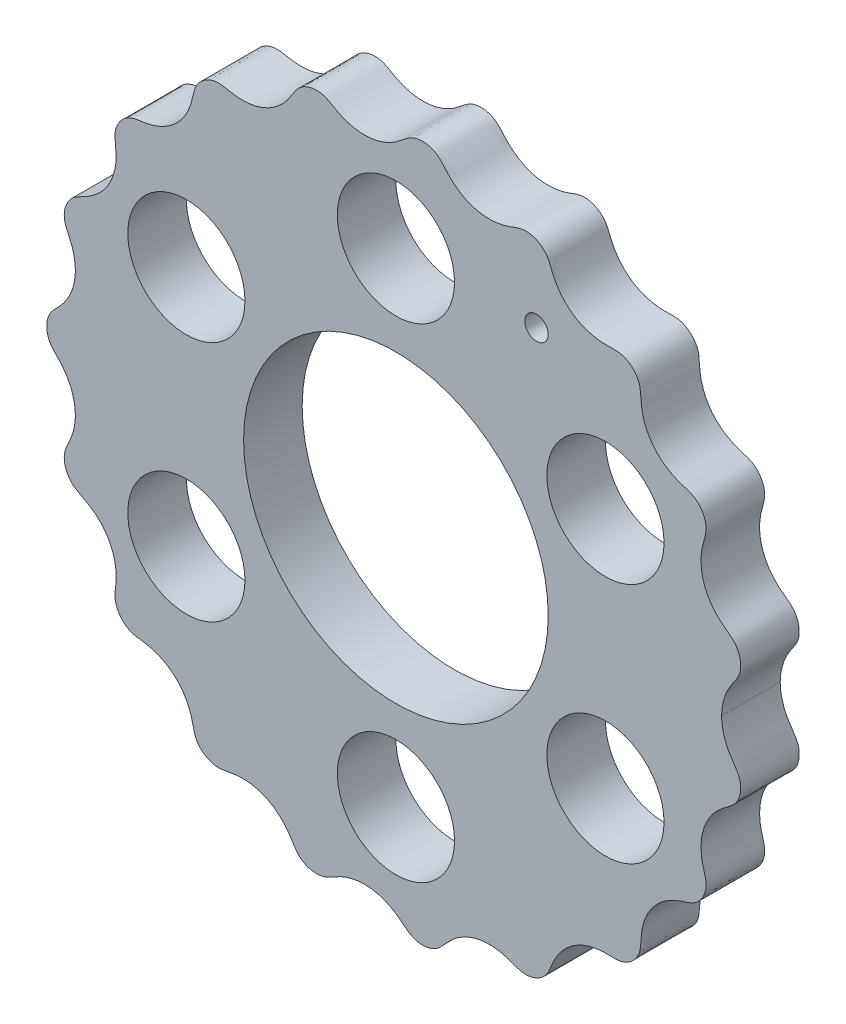
from build123d import *

# Parameters (mm, degrees)
BOSS_EXTRUDE1_DEPTH = 5
SKETCH2_R           = 13
SKETCH2_R_2         = 5
CUT_EXTRUDE1_DEPTH  = 43.654089603
SKETCH3_R           = 1
CUT_EXTRUDE2_DEPTH  = 43.654089603
CUT_EXTRUDE3_DEPTH  = 43.654089603


with BuildPart() as part:
    # Sketch1 → Boss-Extrude1 (new body)
    with BuildSketch(Plane.XY):
        with BuildLine():
            add(Edge.make_bspline(
                [(28, 0), (28, -0.031607794), (28.000789391, -0.095173902), (28.005525755, -0.245757399), (28.019326086, -0.439861268), (28.040961164, -0.616482718), (28.070350501, -0.794934034), (28.098472093, -0.937736676), (28.139322344, -1.115144331), (28.197244662, -1.325319125), (28.300892486, -1.635565804), (28.458642604, -2.006685548), (28.668088032, -2.395563273), (28.928215002, -2.80037836), (29.189681608, -3.161780759), (29.444754064, -3.571082816), (29.605798297, -4.064565501), (29.652918137, -4.626620464), (29.556654021, -5.231189162), (29.327153873, -5.768344938), (28.986297149, -6.210981216), (28.580427206, -6.525512659), (28.197486675, -6.798030109), (27.799996825, -7.121358321), (27.404607047, -7.507202652), (27.032482428, -7.970512965), (26.706330796, -8.514828581), (26.413302695, -9.211657), (26.251438875, -9.933273978), (26.216663756, -10.652450965), (26.287033133, -11.311050735), (26.385737699, -11.786793647), (26.504021433, -12.219948933), (26.622494171, -12.615516869), (26.695325575, -13.060523341), (26.664660067, -13.54855307), (26.519655846, -14.055126303), (26.245608373, -14.551808566), (25.887042333, -14.950855179), (25.471385133, -15.24393249), (25.03131998, -15.417348965), (24.610726837, -15.538975848), (24.164527862, -15.691099177), (23.700275628, -15.888132276), (23.105427802, -16.218766886), (22.53956767, -16.665049073), (22.055230805, -17.205935547), (21.669752323, -17.823580633), (21.42565652, -18.360731693), (21.260433844, -18.894643699), (21.162643882, -19.412199587), (21.112689386, -19.905492718), (21.094498138, -20.368148606), (21.053012922, -20.862501238), (20.881375511, -21.364540757), (20.57591829, -21.843251799), (20.135609481, -22.263720704), (19.634321897, -22.549252922), (19.106731473, -22.697644587), (18.60260508, -22.70733462), (18.141783316, -22.685028739), (17.63910796, -22.691060401), (17.099438227, -22.742871664), (16.529573831, -22.866674399), (15.943933229, -23.078382008), (15.278093513, -23.430068555), (14.692747008, -23.887334661), (14.204931744, -24.42944445), (13.837996841, -24.997872996), (13.613152588, -25.440036584), (13.433275756, -25.861845447), (13.282527262, -26.254985917), (13.072648388, -26.664451214), (12.748934464, -27.04493476), (12.321789669, -27.365459651), (11.799442579, -27.59587664), (11.276706532, -27.695200129), (10.78130439, -27.679350973), (10.340049125, -27.561421688), (9.951329073, -27.407604072), (9.522950605, -27.254106311), (9.049641692, -27.118655209), (8.388840217, -27.000061367), (7.663120595, -26.985676349), (6.93036574, -27.099542528), (6.217390687, -27.344899813), (5.658834075, -27.629674642), (5.176155087, -27.964045149), (4.767565282, -28.326118097), (4.418903404, -28.693269214), (4.120485623, -29.049409536), (3.772522925, -29.419108483), (3.304848005, -29.71243473), (2.754147859, -29.890925208), (2.146773278, -29.932738719), (1.589248405, -29.836110659), (1.105587205, -29.627733503), (0.71417636, -29.328499919), (0.364533333, -29.029925233), (-0.028367799, -28.733309513), (-0.47045994, -28.45415947), (-0.969914774, -28.21234573), (-1.524621917, -28.024945496), (-2.096874589, -27.911552355), (-2.676043085, -27.873611072), (-3.252990345, -27.910342589), (-3.817580804, -28.01958817), (-4.333541884, -28.186149818), (-4.797360885, -28.393401034), (-5.215409768, -28.618899434), (-5.592367418, -28.847426096), (-6.019210711, -29.058949793), (-6.519324313, -29.170764397), (-7.057773467, -29.166815824), (-7.609325551, -29.034349043), (-8.079686668, -28.801036689), (-8.458609902, -28.498106948), (-8.737991675, -28.148379256), (-8.948179734, -27.796339272), (-9.183841522, -27.418183046), (-9.46298228, -27.025023376), (-9.89317018, -26.528263808), (-10.435830545, -26.067373452), (-11.063248917, -25.696323354), (-11.758699629, -25.434985669), (-12.363814894, -25.299234737), (-12.95310346, -25.248195072), (-13.51401526, -25.268546477), (-14.042266274, -25.339057351), (-14.533281872, -25.442118731), (-15.058861896, -25.534533442), (-15.623528223, -25.481944425), (-16.171925598, -25.285915888), (-16.673841481, -24.953621848), (-17.052437871, -24.545388892), (-17.307990578, -24.097893954), (-17.439195953, -23.637404396), (-17.52711835, -23.203153521), (-17.645998359, -22.740668871), (-17.810639096, -22.257067945), (-18.102151448, -21.632046189), (-18.513113629, -21.031341537), (-19.024021846, -20.509148431), (-19.616634941, -20.083071264), (-20.134098627, -19.805250512), (-20.65049718, -19.606303042), (-21.151939853, -19.474775119), (-21.629104056, -19.389994891), (-22.075135097, -19.336471036), (-22.553018741, -19.250202468), (-23.030373049, -19.036443065), (-23.478926292, -18.69128849), (-23.860652457, -18.212594076), (-24.10193098, -17.682815032), (-24.200337707, -17.136759129), (-24.160939597, -16.628102048), (-24.101414735, -16.164975194), (-24.068545385, -15.657122594), (-24.081295518, -15.108587934), (-24.165539546, -14.524481601), (-24.338847541, -13.918660984), (-24.646212755, -13.229279662), (-25.062435608, -12.616598909), (-25.566029832, -12.097280409), (-26.099765663, -11.696331925), (-26.518591227, -11.442780427), (-26.919851592, -11.233649018), (-27.294141099, -11.052353257), (-27.676000835, -10.806303036), (-28.019439933, -10.452794437), (-28.297086409, -10.002715516), (-28.479139599, -9.465413716), (-28.532211586, -8.933514091), (-28.470422962, -8.432585295), (-28.30510669, -7.992998887), (-28.111109147, -7.603856207), (-27.920859103, -7.176405122), (-27.750155987, -6.705838026), (-27.587332984, -6.050500223), (-27.525855635, -5.327505077), (-27.592179736, -4.588799401), (-27.791060781, -3.861084734), (-28.039472038, -3.284473953), (-28.339718127, -2.784159099), (-28.66836889, -2.358383767), (-29.000421457, -1.993187612), (-29.31931866, -1.67875971), (-29.644802089, -1.306256706), (-29.889490433, -0.822075077), (-30.018167595, -0.260629936), (-30.005603598, 0.351165926), (-29.857670959, 0.902647528), (-29.600525577, 1.369935874), (-29.261270256, 1.735325411), (-28.93208093, 2.064249021), (-28.602225255, 2.437898937), (-28.287867883, 2.863964262), (-28.00791907, 3.351112859), (-27.780139784, 3.898808345), (-27.591392943, 4.602767733), (-27.52652236, 5.325017915), (-27.585693157, 6.040729865), (-27.747665385, 6.697782161), (-27.918040246, 7.169552851), (-28.108310492, 7.598064876), (-28.302704998, 7.987933686), (-28.469417458, 8.427972934), (-28.532299241, 8.929815992), (-28.479856748, 9.462293119), (-28.298413482, 9.99977617), (-28.021630931, 10.449766164), (-27.679597868, 10.803169143), (-27.299132875, 11.049699967), (-26.925659315, 11.230826849), (-26.525069425, 11.439193824), (-26.106771915, 11.691660483), (-25.573443616, 12.090790558), (-25.06930278, 12.608299357), (-24.651696231, 13.219664458), (-24.342466537, 13.908552639), (-24.167461761, 14.515140855), (-24.081973824, 15.100196544), (-24.068325043, 15.649739078), (-24.100780663, 16.158568438), (-24.160140276, 16.622562443), (-24.200658465, 17.13203169), (-24.10321497, 17.679315963), (-23.862349693, 18.209869298), (-23.481200106, 18.689000548), (-23.033499346, 19.034377339), (-22.557560754, 19.248698187), (-22.080762596, 19.335831681), (-21.635555765, 19.38906891), (-21.159259908, 19.473240133), (-20.658614704, 19.603726927), (-20.142894794, 19.801310606), (-19.625871508, 20.077399458), (-19.032424918, 20.50179032), (-18.519960475, 21.022894025), (-18.107062631, 21.623399459), (-17.813780942, 22.249170887), (-17.648077145, 22.733499759), (-17.528534764, 23.19680441), (-17.440339572, 23.631857935), (-17.309941788, 24.093521039), (-17.054775403, 24.542465351), (-16.676326181, 24.951558118), (-16.174772931, 25.284465933), (-15.627121463, 25.480954405), (-15.063613699, 25.53464941), (-14.53876576, 25.443428509), (-14.04870116, 25.340176789), (-13.521478788, 25.269265487), (-12.961627928, 25.248019408), (-12.373324213, 25.297856121), (-11.76902426, 25.431982843), (-11.073166575, 25.691475967), (-10.444518868, 26.06110741), (-9.900106679, 26.521373564), (-9.468104218, 27.018429456), (-9.187878067, 27.412050228), (-8.951432681, 27.790813845), (-8.741100667, 28.143685845), (-8.462070912, 28.49483955), (-8.082897568, 28.799133848), (-7.612387114, 29.033287178), (-7.060975379, 29.1663805), (-6.523070969, 29.171013546), (-6.023763363, 29.060429515), (-5.597243323, 28.850320465), (-5.221020217, 28.622168744), (-4.804020718, 28.396750924), (-4.34144437, 28.189229502), (-3.826867386, 28.022064798), (-3.263707624, 27.911793469), (-2.687474286, 27.873644486), (-2.108219562, 27.910045249), (-1.535105702, 28.022097512), (-0.97885137, 28.208615353), (-0.477944331, 28.449973443), (-0.034531935, 28.728967322), (0.359423942, 29.025790431), (0.709883842, 29.324749458), (1.101398688, 29.625371261), (1.585597839, 29.835198804), (2.143546411, 29.932605798), (2.750978647, 29.891510172), (3.301376688, 29.713852462), (3.768744645, 29.422072446), (4.11686597, 29.053820749), (4.41453018, 28.698212895), (4.76216589, 28.331440644), (5.169402529, 27.969392238), (5.650549964, 27.634732213), (6.207434141, 27.349212317), (6.919527271, 27.102132867), (7.652319978, 26.986342148), (8.378999847, 26.999072766), (9.041413413, 27.116706278), (9.515886034, 27.25178552), (9.945292149, 27.405246585), (10.33471801, 27.559502076), (10.776559668, 27.678784076), (11.27298784, 27.695621715), (11.796365764, 27.596880585), (12.318969019, 27.367054398), (12.746103509, 27.047404294), (13.069867171, 26.668359131), (13.280348959, 26.260238466), (13.430902373, 25.867900328), (13.610047168, 25.446819046), (13.833812808, 25.005248611), (14.198936635, 24.437339599), (14.684877711, 23.894794481), (15.268789228, 23.436238019), (15.933972287, 23.08272939), (16.520210963, 22.869297394), (17.090909026, 22.744179265), (17.631517933, 22.691404539), (18.135170603, 22.684880483), (18.596890924, 22.707025842), (19.101983826, 22.698454926), (19.630927767, 22.550859708), (20.133035028, 22.265670012), (20.573843353, 21.845719759), (20.879586327, 21.367847037), (21.051951154, 20.867181872), (21.094363585, 20.373838874), (21.112254643, 19.912049046), (21.16163916, 19.419670361), (21.258405524, 18.902975501), (21.422298212, 18.369812269), (21.664688853, 17.833186737), (22.048443403, 17.21480426), (22.531611071, 16.672432705), (23.097165354, 16.224250491), (23.692651226, 15.891818586), (24.157556718, 15.693706207), (24.604524485, 15.54087327), (25.02589507, 15.418997814), (25.467227187, 15.246310396), (25.884329381, 14.953452562), (26.243767774, 14.554469426), (26.51837393, 14.058101434), (26.663898396, 13.552209679), (26.69541457, 13.065287404), (26.6238773, 12.620985814), (26.505881537, 12.226105108), (26.387505972, 11.793950469), (26.288382081, 11.319319619), (26.216988653, 10.662261885), (26.249859599, 9.94855148), (26.406838821, 9.235805384), (26.689951889, 8.549703765), (27.001615686, 8.017122716), (27.363753231, 7.553123578), (27.758445657, 7.157943098), (28.167019044, 6.819797091), (28.574030178, 6.530556726), (28.994300302, 6.205710581), (29.333751672, 5.754976571), (29.558721638, 5.219338186), (29.652257295, 4.624684413), (29.606457168, 4.068284102), (29.446581732, 3.575497361), (29.193157181, 3.166250105), (28.964301686, 2.851052692), (28.781094604, 2.570740733), (28.629273839, 2.317340988), (28.50744616, 2.091446772), (28.389956154, 1.844472549), (28.280988718, 1.575591254), (28.188669511, 1.299970851), (28.113803282, 1.020663634), (28.056938461, 0.732470454), (28.02335876, 0.489756214), (28.00621284, 0.257787873), (28.001072048, 0.107571885), (28.000106821, 0.044134849), (28.000017774, 0.012592221)],
                knots=[0.065005571, 0.065005571, 0.065005571, 0.065005571, 0.065005571, 0.065632382, 0.066259192, 0.067512814, 0.068139624, 0.068766435, 0.069393246, 0.070020056, 0.071273678, 0.072527299, 0.075034542, 0.076961332, 0.078888123, 0.080814913, 0.082741704, 0.085241291, 0.087740877, 0.090464736, 0.093188594, 0.095219679, 0.097250764, 0.099281849, 0.101312934, 0.104041079, 0.106769225, 0.109497371, 0.112225517, 0.117036609, 0.119442155, 0.121847701, 0.12362792, 0.125408138, 0.127188357, 0.128968576, 0.131365645, 0.133762715, 0.136211626, 0.138660537, 0.140550415, 0.142440294, 0.144330173, 0.146220051, 0.148675368, 0.151130685, 0.156041319, 0.158578939, 0.161116559, 0.16365418, 0.1661918, 0.168192015, 0.17019223, 0.172192445, 0.17419266, 0.176713076, 0.179233492, 0.181907479, 0.184581467, 0.186574673, 0.188567879, 0.190561085, 0.192554291, 0.195232047, 0.197909804, 0.20058756, 0.203265317, 0.208179231, 0.210636188, 0.213093145, 0.214909768, 0.216726391, 0.218543014, 0.220359637, 0.222807476, 0.225255316, 0.227684467, 0.230113618, 0.231916809, 0.233720001, 0.235523192, 0.237326383, 0.239764514, 0.242202645, 0.247078907, 0.249774714, 0.25247052, 0.255166327, 0.257862134, 0.259869718, 0.261877303, 0.263884888, 0.265892473, 0.268584812, 0.271277151, 0.27377903, 0.276280908, 0.278267134, 0.28025336, 0.282239586, 0.284225812, 0.286744865, 0.289263918, 0.291782971, 0.294302024, 0.29677641, 0.299250796, 0.301725182, 0.304199568, 0.306102874, 0.30800618, 0.309909486, 0.311812791, 0.314280353, 0.316747916, 0.31912638, 0.321504844, 0.323272024, 0.325039205, 0.326806386, 0.328573567, 0.330960231, 0.333346894, 0.338120221, 0.340786943, 0.343453665, 0.346120387, 0.348787109, 0.350955367, 0.353123626, 0.355291884, 0.357460142, 0.360114886, 0.362769631, 0.36525072, 0.36773181, 0.36964497, 0.371558131, 0.373471291, 0.375384451, 0.377872698, 0.380360944, 0.385337437, 0.387863626, 0.390389815, 0.392916004, 0.395442193, 0.39738266, 0.399323128, 0.401263595, 0.403204062, 0.405722153, 0.408240244, 0.410945845, 0.413651446, 0.415669141, 0.417686835, 0.41970453, 0.421722225, 0.42443151, 0.427140795, 0.42985008, 0.432559365, 0.437408183, 0.439832592, 0.442257001, 0.444050448, 0.445843895, 0.447637342, 0.449430789, 0.451846436, 0.454262083, 0.456692563, 0.459123043, 0.460999481, 0.462875918, 0.464752356, 0.466628794, 0.469065006, 0.471501219, 0.476373643, 0.479073102, 0.481772561, 0.48447202, 0.487171478, 0.489105866, 0.491040254, 0.492974642, 0.49490903, 0.497596451, 0.500283872, 0.502817705, 0.505351538, 0.507361982, 0.509372426, 0.51138287, 0.513393314, 0.515944415, 0.518495517, 0.521046619, 0.523597721, 0.528480538, 0.530921947, 0.533363356, 0.535243503, 0.537123649, 0.539003796, 0.540883942, 0.543319302, 0.545754661, 0.548165261, 0.550575862, 0.552365695, 0.554155528, 0.555945361, 0.557735194, 0.560154477, 0.56257376, 0.567412327, 0.570126751, 0.572841176, 0.5755556, 0.578270025, 0.580291379, 0.582312733, 0.584334088, 0.586355442, 0.589065971, 0.5917765, 0.594289569, 0.596802638, 0.59873938, 0.600676121, 0.602612862, 0.604549603, 0.607070647, 0.609591691, 0.612112735, 0.614633779, 0.619620609, 0.622114024, 0.624607439, 0.626524293, 0.628441148, 0.630358003, 0.632274858, 0.634760986, 0.637247113, 0.639896985, 0.642546857, 0.644711256, 0.646875655, 0.649040054, 0.651204452, 0.653866281, 0.656528109, 0.659189937, 0.661851765, 0.666635362, 0.669027161, 0.671418959, 0.673189665, 0.67496037, 0.676731076, 0.678501781, 0.680885305, 0.683268829, 0.685731329, 0.688193829, 0.690093472, 0.691993115, 0.693892758, 0.695792401, 0.698261608, 0.700730814, 0.70320002, 0.705669226, 0.708193332, 0.710717438, 0.713241544, 0.71576565, 0.717755672, 0.719745693, 0.721735714, 0.723725736, 0.726232666, 0.728739596, 0.731426962, 0.734114328, 0.736118005, 0.738121682, 0.74012536, 0.742129037, 0.744819939, 0.747510841, 0.750201743, 0.752892646, 0.757779148, 0.760222399, 0.76266565, 0.764472495, 0.766279341, 0.768086186, 0.769893031, 0.77232723, 0.774761429, 0.77720418, 0.77964693, 0.781459893, 0.783272856, 0.785085819, 0.786898782, 0.789350624, 0.791802466, 0.796706149, 0.799388815, 0.80207148, 0.804754146, 0.807436812, 0.809433927, 0.811431043, 0.813428158, 0.815425273, 0.818104265, 0.820783257, 0.823298646, 0.825814036, 0.827810441, 0.829806846, 0.831803251, 0.833799656, 0.836332235, 0.838864814, 0.841397392, 0.843929971, 0.84885098, 0.851311484, 0.853771989, 0.855665504, 0.85755902, 0.859452536, 0.861346052, 0.863800041, 0.866254031, 0.868646044, 0.871038058, 0.872814713, 0.874591369, 0.876368024, 0.878144679, 0.880545094, 0.882945508, 0.887746338, 0.890399934, 0.89305353, 0.895707125, 0.898360721, 0.900518645, 0.902676569, 0.904834493, 0.906992417, 0.909634081, 0.912275745, 0.914770313, 0.917264881, 0.919187956, 0.921111031, 0.923034106, 0.923995643, 0.924957181, 0.926208222, 0.927459264, 0.928710306, 0.929961347, 0.931212389, 0.932463431, 0.933714472, 0.934339993, 0.934965514, 0.934965514, 0.934965514, 0.934965514, 0.934965514], degree=4))
            Line((28.000017774, 0.012592221), (28, 0))
        make_face()
    extrude(amount=BOSS_EXTRUDE1_DEPTH)

    # Sketch2 → Cut-Extrude1 (cut, through all)
    with BuildSketch(Plane.XY.offset(5)):
        Circle(SKETCH2_R)
        with Locations((0, 20.65)):
            Circle(SKETCH2_R_2)
        with Locations((17.883424588, 10.325)):
            Circle(SKETCH2_R_2)
        with Locations((17.883424588, -10.325)):
            Circle(SKETCH2_R_2)
        with Locations((0, -20.65)):
            Circle(SKETCH2_R_2)
        with Locations((-17.883424588, -10.325)):
            Circle(SKETCH2_R_2)
        with Locations((-17.883424588, 10.325)):
            Circle(SKETCH2_R_2)
    extrude(amount=-CUT_EXTRUDE1_DEPTH, mode=Mode.SUBTRACT)

    # Sketch3 → Cut-Extrude2 (cut, through all)
    with BuildSketch(Plane.XY.offset(5)):
        with Locations((12, 20.784609691)):
            Circle(SKETCH3_R)
    extrude(amount=-CUT_EXTRUDE2_DEPTH, mode=Mode.SUBTRACT)

    # Sketch4 → Cut-Extrude3 (cut, through all)
    with BuildSketch(Plane.XY.offset(5)):
        with BuildLine():
            Line((28, 0), (28.000017774, 0.012592221))
            add(Edge.make_bspline(
                [(28.000017774, 0.012592221), (28.000106821, 0.044134849), (28.001072048, 0.107571885), (28.00621284, 0.257787873), (28.02335876, 0.489756214), (28.056938461, 0.732470454), (28.113803282, 1.020663634), (28.188669511, 1.299970851), (28.280988718, 1.575591254), (28.389956154, 1.844472549), (28.50744616, 2.091446772), (28.629273839, 2.317340988), (28.781094604, 2.570740733), (28.964301686, 2.851052692), (29.193157181, 3.166250105), (29.446581732, 3.575497361), (29.606457168, 4.068284102), (29.652257295, 4.624684413), (29.558721638, 5.219338186), (29.333751672, 5.754976571), (28.994300302, 6.205710581), (28.574030178, 6.530556726), (28.167019044, 6.819797091), (27.758445657, 7.157943098), (27.363753231, 7.553123578), (27.001615686, 8.017122716), (26.689951889, 8.549703765), (26.406838821, 9.235805384), (26.249859599, 9.94855148), (26.216988653, 10.662261885), (26.288382081, 11.319319619), (26.387505972, 11.793950469), (26.505881537, 12.226105108), (26.6238773, 12.620985814), (26.69541457, 13.065287404), (26.663898396, 13.552209679), (26.51837393, 14.058101434), (26.243767774, 14.554469426), (25.884329381, 14.953452562), (25.467227187, 15.246310396), (25.02589507, 15.418997814), (24.604524485, 15.54087327), (24.157556718, 15.693706207), (23.692651226, 15.891818586), (23.097165354, 16.224250491), (22.531611071, 16.672432705), (22.048443403, 17.21480426), (21.664688853, 17.833186737), (21.422298212, 18.369812269), (21.258405524, 18.902975501), (21.16163916, 19.419670361), (21.112254643, 19.912049046), (21.094363585, 20.373838874), (21.051951154, 20.867181872), (20.879586327, 21.367847037), (20.573843353, 21.845719759), (20.133035028, 22.265670012), (19.630927767, 22.550859708), (19.101983826, 22.698454926), (18.596890924, 22.707025842), (18.135170603, 22.684880483), (17.631517933, 22.691404539), (17.090909026, 22.744179265), (16.520210963, 22.869297394), (15.933972287, 23.08272939), (15.268789228, 23.436238019), (14.684877711, 23.894794481), (14.198936635, 24.437339599), (13.833812808, 25.005248611), (13.610047168, 25.446819046), (13.430902373, 25.867900328), (13.280348959, 26.260238466), (13.069867171, 26.668359131), (12.746103509, 27.047404294), (12.318969019, 27.367054398), (11.796365764, 27.596880585), (11.27298784, 27.695621715), (10.776559668, 27.678784076), (10.33471801, 27.559502076), (9.945292149, 27.405246585), (9.515886034, 27.25178552), (9.041413413, 27.116706278), (8.378999847, 26.999072766), (7.652319978, 26.986342148), (6.919527271, 27.102132867), (6.207434141, 27.349212317), (5.650549964, 27.634732213), (5.169402529, 27.969392238), (4.76216589, 28.331440644), (4.41453018, 28.698212895), (4.11686597, 29.053820749), (3.768744645, 29.422072446), (3.301376688, 29.713852462), (2.750978647, 29.891510172), (2.143546411, 29.932605798), (1.585597839, 29.835198804), (1.101398688, 29.625371261), (0.709883842, 29.324749458), (0.359423942, 29.025790431), (-0.034531935, 28.728967322), (-0.477944331, 28.449973443), (-0.97885137, 28.208615353), (-1.535105702, 28.022097512), (-2.108219562, 27.910045249), (-2.687474286, 27.873644486), (-3.263707624, 27.911793469), (-3.826867386, 28.022064798), (-4.34144437, 28.189229502), (-4.804020718, 28.396750924), (-5.221020217, 28.622168744), (-5.597243323, 28.850320465), (-6.023763363, 29.060429515), (-6.523070969, 29.171013546), (-7.060975379, 29.1663805), (-7.612387114, 29.033287178), (-8.082897568, 28.799133848), (-8.462070912, 28.49483955), (-8.741100667, 28.143685845), (-8.951432681, 27.790813845), (-9.187878067, 27.412050228), (-9.468104218, 27.018429456), (-9.900106679, 26.521373564), (-10.444518868, 26.06110741), (-11.073166575, 25.691475967), (-11.76902426, 25.431982843), (-12.373324213, 25.297856121), (-12.961627928, 25.248019408), (-13.521478788, 25.269265487), (-14.04870116, 25.340176789), (-14.53876576, 25.443428509), (-15.063613699, 25.53464941), (-15.627121463, 25.480954405), (-16.174772931, 25.284465933), (-16.676326181, 24.951558118), (-17.054775403, 24.542465351), (-17.309941788, 24.093521039), (-17.440339572, 23.631857935), (-17.528534764, 23.19680441), (-17.648077145, 22.733499759), (-17.813780942, 22.249170887), (-18.107062631, 21.623399459), (-18.519960475, 21.022894025), (-19.032424918, 20.50179032), (-19.625871508, 20.077399458), (-20.142894794, 19.801310606), (-20.658614704, 19.603726927), (-21.159259908, 19.473240133), (-21.635555765, 19.38906891), (-22.080762596, 19.335831681), (-22.557560754, 19.248698187), (-23.033499346, 19.034377339), (-23.481200106, 18.689000548), (-23.862349693, 18.209869298), (-24.10321497, 17.679315963), (-24.200658465, 17.13203169), (-24.160140276, 16.622562443), (-24.100780663, 16.158568438), (-24.068325043, 15.649739078), (-24.081973824, 15.100196544), (-24.167461761, 14.515140855), (-24.342466537, 13.908552639), (-24.651696231, 13.219664458), (-25.06930278, 12.608299357), (-25.573443616, 12.090790558), (-26.106771915, 11.691660483), (-26.525069425, 11.439193824), (-26.925659315, 11.230826849), (-27.299132875, 11.049699967), (-27.679597868, 10.803169143), (-28.021630931, 10.449766164), (-28.298413482, 9.99977617), (-28.479856748, 9.462293119), (-28.532299241, 8.929815992), (-28.469417458, 8.427972934), (-28.302704998, 7.987933686), (-28.108310492, 7.598064876), (-27.918040246, 7.169552851), (-27.747665385, 6.697782161), (-27.585693157, 6.040729865), (-27.52652236, 5.325017915), (-27.591392943, 4.602767733), (-27.780139784, 3.898808345), (-28.00791907, 3.351112859), (-28.287867883, 2.863964262), (-28.602225255, 2.437898937), (-28.93208093, 2.064249021), (-29.261270256, 1.735325411), (-29.600525577, 1.369935874), (-29.857670959, 0.902647528), (-30.005603598, 0.351165926), (-30.018167595, -0.260629936), (-29.889490433, -0.822075077), (-29.644802089, -1.306256706), (-29.31931866, -1.67875971), (-29.000421457, -1.993187612), (-28.66836889, -2.358383767), (-28.339718127, -2.784159099), (-28.039472038, -3.284473953), (-27.791060781, -3.861084734), (-27.592179736, -4.588799401), (-27.525855635, -5.327505077), (-27.587332984, -6.050500223), (-27.750155987, -6.705838026), (-27.920859103, -7.176405122), (-28.111109147, -7.603856207), (-28.30510669, -7.992998887), (-28.470422962, -8.432585295), (-28.532211586, -8.933514091), (-28.479139599, -9.465413716), (-28.297086409, -10.002715516), (-28.019439933, -10.452794437), (-27.676000835, -10.806303036), (-27.294141099, -11.052353257), (-26.919851592, -11.233649018), (-26.518591227, -11.442780427), (-26.099765663, -11.696331925), (-25.566029832, -12.097280409), (-25.062435608, -12.616598909), (-24.646212755, -13.229279662), (-24.338847541, -13.918660984), (-24.165539546, -14.524481601), (-24.081295518, -15.108587934), (-24.068545385, -15.657122594), (-24.101414735, -16.164975194), (-24.160939597, -16.628102048), (-24.200337707, -17.136759129), (-24.10193098, -17.682815032), (-23.860652457, -18.212594076), (-23.478926292, -18.69128849), (-23.030373049, -19.036443065), (-22.553018741, -19.250202468), (-22.075135097, -19.336471036), (-21.629104056, -19.389994891), (-21.151939853, -19.474775119), (-20.65049718, -19.606303042), (-20.134098627, -19.805250512), (-19.616634941, -20.083071264), (-19.024021846, -20.509148431), (-18.513113629, -21.031341537), (-18.102151448, -21.632046189), (-17.810639096, -22.257067945), (-17.645998359, -22.740668871), (-17.52711835, -23.203153521), (-17.439195953, -23.637404396), (-17.307990578, -24.097893954), (-17.052437871, -24.545388892), (-16.673841481, -24.953621848), (-16.171925598, -25.285915888), (-15.623528223, -25.481944425), (-15.058861896, -25.534533442), (-14.533281872, -25.442118731), (-14.042266274, -25.339057351), (-13.51401526, -25.268546477), (-12.95310346, -25.248195072), (-12.363814894, -25.299234737), (-11.758699629, -25.434985669), (-11.063248917, -25.696323354), (-10.435830545, -26.067373452), (-9.89317018, -26.528263808), (-9.46298228, -27.025023376), (-9.183841522, -27.418183046), (-8.948179734, -27.796339272), (-8.737991675, -28.148379256), (-8.458609902, -28.498106948), (-8.079686668, -28.801036689), (-7.609325551, -29.034349043), (-7.057773467, -29.166815824), (-6.519324313, -29.170764397), (-6.019210711, -29.058949793), (-5.592367418, -28.847426096), (-5.215409768, -28.618899434), (-4.797360885, -28.393401034), (-4.333541884, -28.186149818), (-3.817580804, -28.01958817), (-3.252990345, -27.910342589), (-2.676043085, -27.873611072), (-2.096874589, -27.911552355), (-1.524621917, -28.024945496), (-0.969914774, -28.21234573), (-0.47045994, -28.45415947), (-0.028367799, -28.733309513), (0.364533333, -29.029925233), (0.71417636, -29.328499919), (1.105587205, -29.627733503), (1.589248405, -29.836110659), (2.146773278, -29.932738719), (2.754147859, -29.890925208), (3.304848005, -29.71243473), (3.772522925, -29.419108483), (4.120485623, -29.049409536), (4.418903404, -28.693269214), (4.767565282, -28.326118097), (5.176155087, -27.964045149), (5.658834075, -27.629674642), (6.217390687, -27.344899813), (6.93036574, -27.099542528), (7.663120595, -26.985676349), (8.388840217, -27.000061367), (9.049641692, -27.118655209), (9.522950605, -27.254106311), (9.951329073, -27.407604072), (10.340049125, -27.561421688), (10.78130439, -27.679350973), (11.276706532, -27.695200129), (11.799442579, -27.59587664), (12.321789669, -27.365459651), (12.748934464, -27.04493476), (13.072648388, -26.664451214), (13.282527262, -26.254985917), (13.433275756, -25.861845447), (13.613152588, -25.440036584), (13.837996841, -24.997872996), (14.204931744, -24.42944445), (14.692747008, -23.887334661), (15.278093513, -23.430068555), (15.943933229, -23.078382008), (16.529573831, -22.866674399), (17.099438227, -22.742871664), (17.63910796, -22.691060401), (18.141783316, -22.685028739), (18.60260508, -22.70733462), (19.106731473, -22.697644587), (19.634321897, -22.549252922), (20.135609481, -22.263720704), (20.57591829, -21.843251799), (20.881375511, -21.364540757), (21.053012922, -20.862501238), (21.094498138, -20.368148606), (21.112689386, -19.905492718), (21.162643882, -19.412199587), (21.260433844, -18.894643699), (21.42565652, -18.360731693), (21.669752323, -17.823580633), (22.055230805, -17.205935547), (22.53956767, -16.665049073), (23.105427802, -16.218766886), (23.700275628, -15.888132276), (24.164527862, -15.691099177), (24.610726837, -15.538975848), (25.03131998, -15.417348965), (25.471385133, -15.24393249), (25.887042333, -14.950855179), (26.245608373, -14.551808566), (26.519655846, -14.055126303), (26.664660067, -13.54855307), (26.695325575, -13.060523341), (26.622494171, -12.615516869), (26.504021433, -12.219948933), (26.385737699, -11.786793647), (26.287033133, -11.311050735), (26.216663756, -10.652450965), (26.251438875, -9.933273978), (26.413302695, -9.211657), (26.706330796, -8.514828581), (27.032482428, -7.970512965), (27.404607047, -7.507202652), (27.799996825, -7.121358321), (28.197486675, -6.798030109), (28.580427206, -6.525512659), (28.986297149, -6.210981216), (29.327153873, -5.768344938), (29.556654021, -5.231189162), (29.652918137, -4.626620464), (29.605798297, -4.064565501), (29.444754064, -3.571082816), (29.189681608, -3.161780759), (28.928215002, -2.80037836), (28.668088032, -2.395563273), (28.458642604, -2.006685548), (28.300892486, -1.635565804), (28.197244662, -1.325319125), (28.139322344, -1.115144331), (28.098472093, -0.937736676), (28.070350501, -0.794934034), (28.040961164, -0.616482718), (28.019326086, -0.439861268), (28.005525755, -0.245757399), (28.000789391, -0.095173902), (28, -0.031607794), (28, 0)],
                knots=[0.065005571, 0.065005571, 0.065005571, 0.065005571, 0.065005571, 0.065631092, 0.066256613, 0.067507655, 0.068758696, 0.070009738, 0.07126078, 0.072511821, 0.073762863, 0.075013905, 0.075975442, 0.076936979, 0.078860054, 0.080783129, 0.082706204, 0.085200772, 0.08769534, 0.090337004, 0.092978668, 0.095136592, 0.097294516, 0.09945244, 0.101610364, 0.10426396, 0.106917556, 0.109571151, 0.112224747, 0.117025577, 0.119425992, 0.121826406, 0.123603061, 0.125379717, 0.127156372, 0.128933027, 0.131325041, 0.133717055, 0.136171044, 0.138625033, 0.140518549, 0.142412065, 0.144305581, 0.146199097, 0.148659601, 0.151120105, 0.156041114, 0.158573693, 0.161106272, 0.16363885, 0.166171429, 0.168167834, 0.170164239, 0.172160645, 0.17415705, 0.176672439, 0.179187828, 0.18186682, 0.184545812, 0.186542927, 0.188540043, 0.190537158, 0.192534273, 0.195216939, 0.197899605, 0.200582271, 0.203264936, 0.20816862, 0.210620461, 0.213072303, 0.214885266, 0.216698229, 0.218511192, 0.220324155, 0.222766905, 0.225209656, 0.227643855, 0.230078054, 0.231884899, 0.233691745, 0.23549859, 0.237305435, 0.239748686, 0.242191937, 0.24707844, 0.249769342, 0.252460244, 0.255151146, 0.257842049, 0.259845726, 0.261849403, 0.26385308, 0.265856757, 0.268544123, 0.271231489, 0.273738419, 0.276245349, 0.278235371, 0.280225392, 0.282215414, 0.284205435, 0.286729541, 0.289253647, 0.291777753, 0.29430186, 0.296771066, 0.299240272, 0.301709478, 0.304178684, 0.306078327, 0.30797797, 0.309877613, 0.311777256, 0.314239756, 0.316702257, 0.31908578, 0.321469304, 0.32324001, 0.325010715, 0.326781421, 0.328552126, 0.330943924, 0.333335723, 0.33811932, 0.340781148, 0.343442976, 0.346104805, 0.348766633, 0.350931032, 0.35309543, 0.355259829, 0.357424228, 0.3600741, 0.362723972, 0.365210099, 0.367696227, 0.369613082, 0.371529937, 0.373446792, 0.375363647, 0.377857062, 0.380350477, 0.385337306, 0.38785835, 0.390379394, 0.392900438, 0.395421482, 0.397358223, 0.399294964, 0.401231706, 0.403168447, 0.405681516, 0.408194585, 0.410905114, 0.413615643, 0.415636998, 0.417658352, 0.419679706, 0.421701061, 0.424415485, 0.42712991, 0.429844334, 0.432558759, 0.437397325, 0.439816608, 0.442235892, 0.444025725, 0.445815558, 0.447605391, 0.449395224, 0.451805824, 0.454216424, 0.456651784, 0.459087143, 0.460967289, 0.462847436, 0.464727582, 0.466607729, 0.469049138, 0.471490547, 0.476373365, 0.478924466, 0.481475568, 0.48402667, 0.486577772, 0.488588215, 0.490598659, 0.492609103, 0.494619547, 0.49715338, 0.499687213, 0.502374634, 0.505062056, 0.506996443, 0.508930831, 0.510865219, 0.512799607, 0.515499066, 0.518198524, 0.520897983, 0.523597442, 0.528469867, 0.530906079, 0.533342291, 0.535218729, 0.537095167, 0.538971605, 0.540848042, 0.543278522, 0.545709002, 0.548124649, 0.550540296, 0.552333743, 0.55412719, 0.555920637, 0.557714084, 0.560138493, 0.562562902, 0.56741172, 0.570121005, 0.57283029, 0.575539575, 0.57824886, 0.580266555, 0.58228425, 0.584301945, 0.586319639, 0.58902524, 0.591730841, 0.594248932, 0.596767023, 0.59870749, 0.600647957, 0.602588425, 0.604528892, 0.607055081, 0.60958127, 0.612107459, 0.614633648, 0.619610141, 0.622098387, 0.624586634, 0.626499794, 0.628412954, 0.630326115, 0.632239275, 0.634720365, 0.637201454, 0.639856199, 0.642510943, 0.644679201, 0.64684746, 0.649015718, 0.651183976, 0.653850698, 0.65651742, 0.659184142, 0.661850864, 0.666624191, 0.669010855, 0.671397518, 0.673164699, 0.67493188, 0.676699061, 0.678466242, 0.680844706, 0.68322317, 0.685690732, 0.688158294, 0.6900616, 0.691964905, 0.693868211, 0.695771517, 0.698245903, 0.700720289, 0.703194675, 0.705669061, 0.708188114, 0.710707167, 0.71322622, 0.715745273, 0.717731499, 0.719717725, 0.721703951, 0.723690177, 0.726192055, 0.728693934, 0.731386273, 0.734078612, 0.736086197, 0.738093782, 0.740101367, 0.742108952, 0.744804758, 0.747500565, 0.750196371, 0.752892178, 0.75776844, 0.760206571, 0.762644702, 0.764447894, 0.766251085, 0.768054276, 0.769857467, 0.772286618, 0.774715769, 0.777163609, 0.779611448, 0.781428071, 0.783244694, 0.785061317, 0.78687794, 0.789334897, 0.791791854, 0.796705768, 0.799383525, 0.802061281, 0.804739038, 0.807416795, 0.809410001, 0.811403206, 0.813396412, 0.815389618, 0.818063606, 0.820737593, 0.823258009, 0.825778425, 0.82777864, 0.829778855, 0.83177907, 0.833779285, 0.836316906, 0.838854526, 0.841392146, 0.843929766, 0.8488404, 0.851295717, 0.853751034, 0.855640912, 0.857530791, 0.85942067, 0.861310548, 0.863759459, 0.866208371, 0.86860544, 0.871002509, 0.872782728, 0.874562947, 0.876343166, 0.878123384, 0.88052893, 0.882934476, 0.887745568, 0.890473714, 0.89320186, 0.895930006, 0.898658152, 0.900689236, 0.902720321, 0.904751406, 0.906782491, 0.909506349, 0.912230208, 0.914729794, 0.917229381, 0.919156172, 0.921082962, 0.923009753, 0.924936544, 0.927443786, 0.928697408, 0.929951029, 0.930577839, 0.93120465, 0.931831461, 0.932458271, 0.933711893, 0.934338703, 0.934965514, 0.934965514, 0.934965514, 0.934965514, 0.934965514], degree=4))
        make_face()
        with BuildLine():
            Line((27.8, 0.000141153), (27.800018571, 0.013156832))
            add(Edge.make_bspline(
                [(27.800018571, 0.013156832), (27.800202675, 0.078370884), (27.803581818, 0.202693776), (27.822500571, 0.49965908), (27.887339943, 0.963713333), (28.068836638, 1.634710232), (28.412691013, 2.378253568), (28.867490422, 3.062444298), (29.296893656, 3.674398385), (29.45833913, 4.380617846), (29.388686092, 5.111348187), (29.096346564, 5.788664046), (28.590167414, 6.289213989), (27.701543099, 6.892109312), (26.74482521, 7.89946168), (26.072481913, 9.432174535), (25.996397905, 10.821441656), (26.193677417, 11.897097366), (26.44419444, 12.656239912), (26.509930575, 13.363640161), (26.306422056, 14.073130758), (25.896013146, 14.682684913), (25.323963109, 15.120190604), (24.595846149, 15.330766926), (23.562211806, 15.691335986), (22.392377085, 16.437056246), (21.379348032, 17.772175469), (20.972298612, 19.09766535), (20.900069181, 20.1880436), (20.85406052, 20.928971581), (20.534426502, 21.581689957), (20.022369729, 22.107094206), (19.370647171, 22.451451962), (18.659835221, 22.5207798), (17.852876723, 22.471309634), (16.763740281, 22.566628519), (15.444612498, 23.01290018), (14.148634372, 24.070748322), (13.435238975, 25.264997904), (13.08105779, 26.265035254), (12.685179479, 26.854749492), (12.082220487, 27.280314545), (11.379794742, 27.498339029), (10.662157383, 27.477609049), (9.954777128, 27.188454401), (9.174494591, 26.932663245), (8.09287191, 26.753587577), (6.703993999, 26.878002295), (5.448191388, 27.483217257), (4.608667332, 28.184941152), (4.068472419, 28.801079873), (3.573268098, 29.3463697), (2.912355391, 29.654129376), (2.184440319, 29.742406265), (1.461627428, 29.602426147), (0.864127234, 29.206519714), (0.049087859, 28.495762917), (-1.17270448, 27.838129884), (-2.829027363, 27.592068485), (-4.18872213, 27.88338702), (-5.176007152, 28.35407482), (-5.84201924, 28.779964694), (-6.521539111, 28.98724326), (-7.257900388, 28.941285392), (-7.942533298, 28.67088953), (-8.484905528, 28.20350394), (-8.864621023, 27.533238747), (-9.482366812, 26.6303194), (-10.509182866, 25.695416701), (-12.063603984, 25.07028442), (-13.449529147, 25.023722541), (-14.518276523, 25.23727598), (-15.241118698, 25.351769027), (-15.950638975, 25.175599685), (-16.572922949, 24.788186967), (-17.047647012, 24.226662961), (-17.263464782, 23.539891664), (-17.423434198, 22.74207299), (-17.798833498, 21.715083495), (-18.576287071, 20.559151332), (-19.712248602, 19.749696086), (-20.738971351, 19.361208222), (-21.54202359, 19.190565064), (-22.324073659, 19.117679123), (-22.9823439, 18.848630724), (-23.527222925, 18.351796404), (-23.891659187, 17.711707605), (-24.017327409, 17.0091003), (-23.900914511, 16.241985164), (-23.85780079, 15.42158797), (-23.967177772, 14.330185543), (-24.452991084, 13.022702904), (-25.366897867, 11.970939195), (-26.262788941, 11.343159861), (-26.996232581, 10.982219894), (-27.625873284, 10.620652326), (-28.068667962, 10.036821774), (-28.31047893, 9.345050991), (-28.32811005, 8.611293008), (-28.06260264, 7.938276631), (-27.582660561, 6.962387384), (-27.268377429, 5.611985381), (-27.467035212, 3.948463912), (-28.103887531, 2.71401789), (-28.816773259, 1.883294931), (-29.383881566, 1.347773115), (-29.725041827, 0.72223091), (-29.838402552, -0.006002223), (-29.721351849, -0.73371353), (-29.375963777, -1.356373865), (-28.807137247, -1.892510827), (-28.096715927, -2.725176476), (-27.462931367, -3.961527547), (-27.269225717, -5.625541436), (-27.587149414, -6.975181282), (-28.068810474, -7.949372116), (-28.329868358, -8.622741212), (-28.308333512, -9.356864774), (-28.062931785, -10.047393718), (-27.617315558, -10.628369141), (-26.984397292, -10.987192715), (-26.251362722, -11.350003327), (-25.356940282, -11.979995413), (-24.446035462, -13.03446941), (-23.964048101, -14.343331259), (-23.857497842, -15.434882322), (-23.902764514, -16.255211476), (-24.017891026, -17.020632423), (-23.887296717, -17.722949995), (-23.519765441, -18.361058227), (-22.972339738, -18.855275037), (-22.312498746, -19.119511406), (-21.528749782, -19.192262683), (-20.726200883, -19.364955752), (-19.700386475, -19.756179171), (-18.566768085, -20.568961665), (-17.792701479, -21.727044681), (-17.419810631, -22.754905174), (-17.261527919, -23.552338687), (-17.041742793, -24.236710184), (-16.563865813, -24.796037349), (-15.939527007, -25.180266498), (-15.22964802, -25.352311603), (-14.505798538, -25.233929065), (-13.436070662, -25.022811077), (-12.050273419, -25.073014378), (-10.49765806, -25.702766441), (-9.473456566, -26.640301326), (-8.858058982, -27.544825663), (-8.478076269, -28.212762174), (-7.932080203, -28.676932444), (-7.24627128, -28.943820563), (-6.509613792, -28.986147576), (-5.831757002, -28.774055239), (-5.164431245, -28.347373425), (-4.176008494, -27.87920673), (-2.815351202, -27.591630719), (-1.159845587, -27.842454666), (0.06025462, -28.503553622), (0.87327115, -29.215035686), (1.472597311, -29.60651697), (2.196402232, -29.74284906), (2.923953814, -29.650805268), (3.582461613, -29.339554179), (4.076332179, -28.790707735), (4.618241471, -28.175706942), (5.459558357, -27.475970271), (6.717173456, -26.874387132), (8.106372685, -26.754033085), (9.187409788, -26.935816913), (9.967008412, -27.193659386), (10.67325364, -27.480443065), (11.391737662, -27.496505294), (12.092875238, -27.274992622), (12.693749861, -26.846440655), (13.08538196, -26.253879159), (13.440671148, -25.2523516), (14.157580419, -24.060590536), (15.456562195, -23.006245053), (16.776872519, -22.563839926), (17.866227946, -22.471169741), (18.672155998, -22.521784615), (19.381798578, -22.447693854), (20.031952404, -22.099954796), (20.541400022, -21.571826658), (20.85684499, -20.917895369), (20.899955422, -20.174949433), (20.974949287, -19.08449315), (21.38548968, -17.760003887), (22.402495517, -16.427889189), (23.574181394, -15.685317446), (24.608673451, -15.327463819), (25.334313088, -15.115371227), (25.904180405, -14.673774852), (26.311389739, -14.062297338), (26.511370034, -13.351830193), (26.440578067, -12.644742071), (26.190253942, -11.884171905), (25.995658833, -10.808064458), (26.075670216, -9.418880999), (26.752364389, -7.888131675), (27.712002968, -6.883501941), (28.600522198, -6.28248816), (29.102666826, -5.77851401), (29.391637378, -5.099827563), (29.45760627, -4.368620771), (29.292072338, -3.664140652), (28.859396669, -3.051997284), (28.406423995, -2.36656979), (28.064258644, -1.62213968), (27.8845829, -0.950770936), (27.821097437, -0.486568519), (27.803018521, -0.18934128), (27.8, -0.065065226), (27.8, 0.000141153)],
                knots=[0.065005571, 0.065005571, 0.065005571, 0.065005571, 0.065855142, 0.066704713, 0.068403855, 0.071802139, 0.075200422, 0.078598706, 0.08199699, 0.085395274, 0.088793558, 0.092191841, 0.095590125, 0.098988409, 0.105784976, 0.112581544, 0.119378111, 0.122776395, 0.126174679, 0.129572963, 0.132971246, 0.13636953, 0.139767814, 0.143166098, 0.146564381, 0.153360949, 0.160157516, 0.166954084, 0.170352368, 0.173750652, 0.177148935, 0.180547219, 0.183945503, 0.187343787, 0.19074207, 0.194140354, 0.200936922, 0.207733489, 0.214530057, 0.21792834, 0.221326624, 0.224724908, 0.228123192, 0.231521475, 0.234919759, 0.238318043, 0.241716327, 0.248512894, 0.255309462, 0.258707746, 0.262106029, 0.265504313, 0.268902597, 0.272300881, 0.275699164, 0.279097448, 0.282495732, 0.289292299, 0.296088867, 0.302885434, 0.306283718, 0.309682002, 0.313080286, 0.316478569, 0.319876853, 0.323275137, 0.326673421, 0.330071704, 0.336868272, 0.34366484, 0.350461407, 0.353859691, 0.357257975, 0.360656258, 0.364054542, 0.367452826, 0.37085111, 0.374249393, 0.377647677, 0.384444245, 0.391240812, 0.394639096, 0.39803738, 0.401435663, 0.404833947, 0.408232231, 0.411630515, 0.415028798, 0.418427082, 0.421825366, 0.42522365, 0.432020217, 0.438816785, 0.442215069, 0.445613352, 0.449011636, 0.45240992, 0.455808204, 0.459206487, 0.462604771, 0.466003055, 0.472799622, 0.47959619, 0.486392757, 0.489791041, 0.493189325, 0.496587609, 0.499985892, 0.503384176, 0.50678246, 0.510180744, 0.513579028, 0.520375595, 0.527172163, 0.53396873, 0.537367014, 0.540765298, 0.544163581, 0.547561865, 0.550960149, 0.554358433, 0.557756716, 0.561155, 0.567951568, 0.574748135, 0.578146419, 0.581544703, 0.584942986, 0.58834127, 0.591739554, 0.595137838, 0.598536122, 0.601934405, 0.605332689, 0.608730973, 0.61552754, 0.622324108, 0.625722392, 0.629120675, 0.632518959, 0.635917243, 0.639315527, 0.64271381, 0.646112094, 0.649510378, 0.656306945, 0.663103513, 0.66990008, 0.673298364, 0.676696648, 0.680094932, 0.683493216, 0.686891499, 0.690289783, 0.693688067, 0.697086351, 0.703882918, 0.710679486, 0.717476053, 0.720874337, 0.724272621, 0.727670904, 0.731069188, 0.734467472, 0.737865756, 0.741264039, 0.744662323, 0.751458891, 0.758255458, 0.761653742, 0.765052026, 0.76845031, 0.771848593, 0.775246877, 0.778645161, 0.782043445, 0.785441728, 0.792238296, 0.799034863, 0.805831431, 0.809229715, 0.812627998, 0.816026282, 0.819424566, 0.82282285, 0.826221133, 0.829619417, 0.833017701, 0.839814269, 0.846610836, 0.853407404, 0.856805687, 0.860203971, 0.863602255, 0.867000539, 0.870398822, 0.873797106, 0.87719539, 0.880593674, 0.887390241, 0.894186809, 0.900983376, 0.90438166, 0.907779944, 0.911178227, 0.914576511, 0.917974795, 0.921373079, 0.924771363, 0.928169646, 0.93156793, 0.933267072, 0.934116643, 0.934966214, 0.934966214, 0.934966214, 0.934966214], degree=3))
        make_face(mode=Mode.SUBTRACT)
    extrude(amount=-CUT_EXTRUDE3_DEPTH, mode=Mode.SUBTRACT)


solid = part.part
